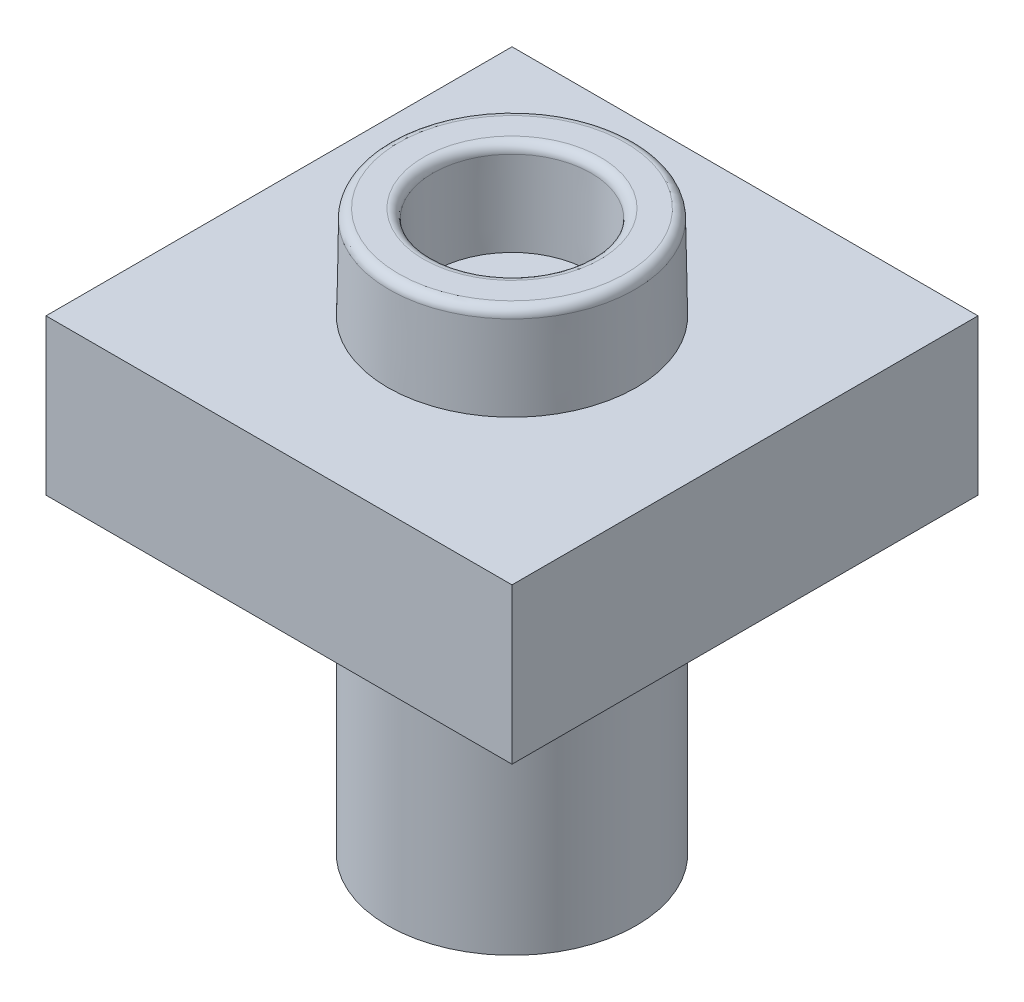
from build123d import *

# Parameters (mm, degrees)
SKETCH1_W           = 15
SKETCH1_H           = 15
BOSS_EXTRUDE1_DEPTH = 5
SKETCH2_R           = 4
SKETCH2_R_2         = 2.5
BOSS_EXTRUDE2_DEPTH = 3
BOSS_EXTRUDE2_DRAFT = 1
FILLET1_R           = 0.3
SKETCH3_R           = 4
BOSS_EXTRUDE3_DEPTH = 10


with BuildPart() as part:
    # Sketch1 → Boss-Extrude1 (new body)
    with BuildSketch(Plane(origin=(0, 0, 0), x_dir=(1, 0, 0), z_dir=(0, 1, 0))):
        Rectangle(SKETCH1_W, SKETCH1_H)
    extrude(amount=BOSS_EXTRUDE1_DEPTH)


with BuildPart() as boss_extrude2_tool:
    # Sketch2 → Boss-Extrude2 (with draft: the straight prism first)
    with BuildSketch(Plane(origin=(0, 5, 0), x_dir=(1, 0, 0), z_dir=(0, 1, 0))):
        Circle(SKETCH2_R)
        Circle(SKETCH2_R_2, mode=Mode.SUBTRACT)
    extrude(amount=BOSS_EXTRUDE2_DEPTH)
    # Boss-Extrude2: the draft: its side faces are tilted about the plane it starts from
    boss_extrude2_sides = [boss_extrude2_tool.faces().sort_by_distance(p)[0] for p in [
        (-4, 6.5, 0),
        (-2.5, 6.5, 0),
    ]]
    draft(boss_extrude2_sides, Plane(origin=(0, 5, 0), x_dir=(1, 0, 0), z_dir=(0, 1, 0)), BOSS_EXTRUDE2_DRAFT)


with BuildPart() as part_1:
    add(part.part)

    # Boss-Extrude2: add boss_extrude2_tool
    add(boss_extrude2_tool.part)

    # Fillet1
    fillet1_edges = [part_1.edges().sort_by_distance(p)[0] for p in [
        (-3.947634805, 8, 0),
        (-2.552365195, 8, 0),
    ]]
    fillet(fillet1_edges, radius=FILLET1_R)

    # Sketch3 → Boss-Extrude3 (add)
    with BuildSketch(Plane.XZ):
        with Locations(Location((0, 0, 0), (0, 0, 270))):
            Circle(SKETCH3_R)
    extrude(amount=BOSS_EXTRUDE3_DEPTH)


solid = part_1.part
